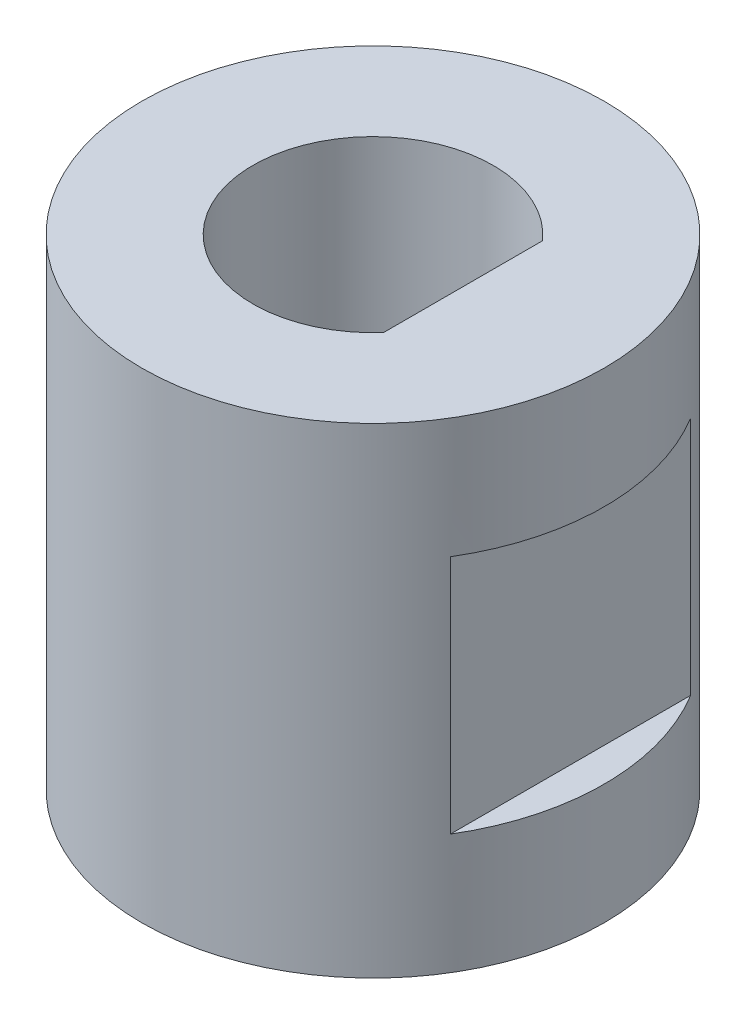
from build123d import *
from build123d.topology import SkipClean

# Parameters (mm, degrees)
SKETCH1_R           = 3.85
BOSS_EXTRUDE1_DEPTH = 2
BOSS_EXTRUDE2_DEPTH = 4
SKETCH4_R           = 3.85
BOSS_EXTRUDE3_DEPTH = 2
CUT_EXTRUDE1_DEPTH  = 10.67703467


with BuildPart() as part:
    # Sketch1 → Boss-Extrude1 (new body)
    with BuildSketch(Plane(origin=(0, 0, 0), x_dir=(1, 0, 0), z_dir=(0, 1, 0))):
        with Locations(Location((0, 0, 0), (0, 0, 270))):
            Circle(SKETCH1_R)
    extrude(amount=BOSS_EXTRUDE1_DEPTH)

    # Sketch3 → Boss-Extrude2 (add)
    with SkipClean():  # the faces are left unmerged after this step: merging them gives an invalid solid
        with BuildSketch(Plane(origin=(0, 2, 0), x_dir=(1, 0, 0), z_dir=(0, 1, 0))):
            with BuildLine():
                Line((3.28975683, 2), (3.28975683, -2))
                ThreePointArc((3.28975683, -2), (-2.722361108, -2.722361108), (-2, 3.28975683))
                Line((-2, 3.28975683), (2, 3.28975683))
                ThreePointArc((2, 3.28975683), (2.722361108, 2.722361108), (3.28975683, 2))
            make_face()
        extrude(amount=BOSS_EXTRUDE2_DEPTH)

    # Sketch4 → Boss-Extrude3 (add)
    with SkipClean():  # the faces are left unmerged after this step: merging them gives an invalid solid
        with BuildSketch(Plane(origin=(0, 6, 0), x_dir=(1, 0, 0), z_dir=(0, 1, 0))):
            with Locations(Location((0, 0, 0), (0, 0, 270))):
                Circle(SKETCH4_R)
        extrude(amount=BOSS_EXTRUDE3_DEPTH)

    # Sketch5 → Cut-Extrude1 (cut, through all)
    with SkipClean():  # the faces are left unmerged after this step: merging them gives an invalid solid
        with BuildSketch(Plane(origin=(0, 8, 0), x_dir=(1, 0, 0), z_dir=(0, 1, 0))):
            with BuildLine():
                Line((1.5, 1.322875656), (1.5, -1.322875656))
                ThreePointArc((1.5, -1.322875656), (-2, 0), (1.5, 1.322875656))
            make_face()
        extrude(amount=-CUT_EXTRUDE1_DEPTH, mode=Mode.SUBTRACT)


solid = part.part
